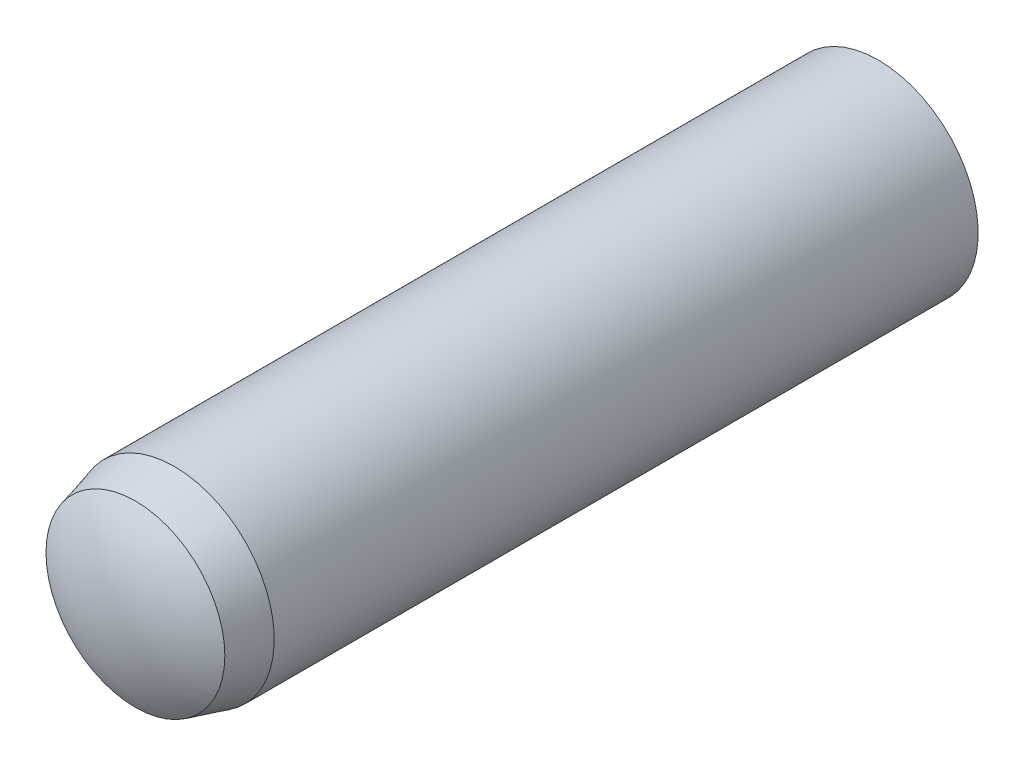
from build123d import *


with BuildPart() as part:
    # Sketch3 → Revolve1 (revolve)
    with BuildSketch(Plane(origin=(0, 0, 0), x_dir=(0, 0, -1), z_dir=(1, 0, 0))):
        with BuildLine():
            Line((-10, 0), (10, 0))
            ThreePointArc((10, 0), (9.808461045, 1.305038314), (9.25, 2.5))
            Line((9.25, 2.5), (-8.375, 2.5))
            Line((-8.375, 2.5), (-9.35, 2.238749537))
            ThreePointArc((-9.35, 2.238749537), (-9.834212566, 1.165600649), (-10, 0))
        make_face()
    revolve(axis=Axis((0, 0, 10), (0, 0, -1)))


solid = part.part
